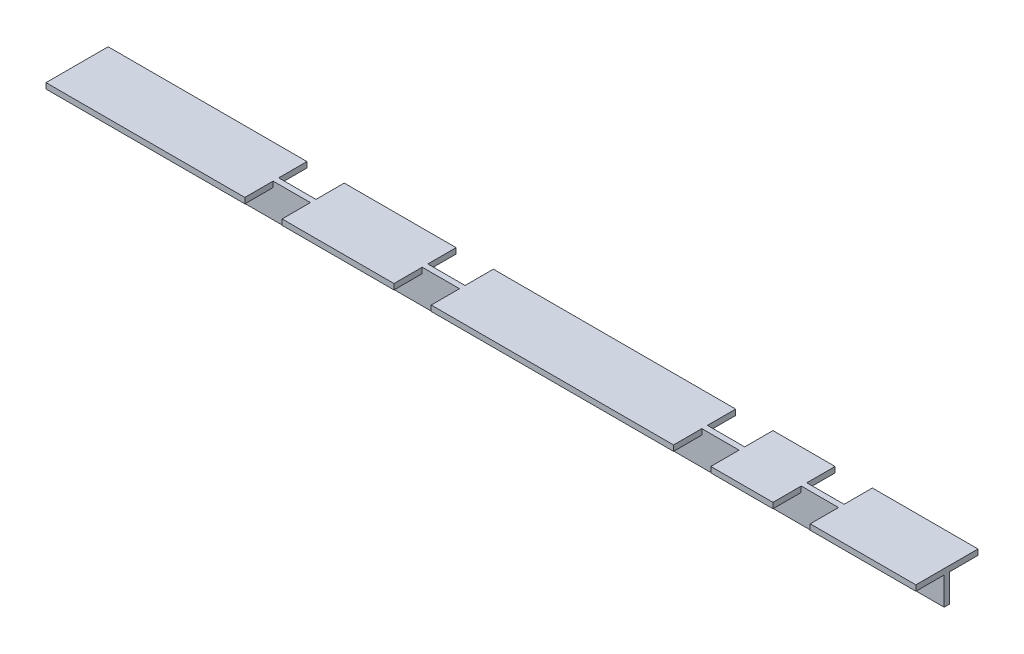
from build123d import *

# Parameters (mm, degrees)
BOSS_EXTRUDE1_DEPTH = 1400
SKETCH1_W           = 60
SKETCH1_H           = 45.5
CUT_EXTRUDE1_DEPTH  = 1405.288075859


with BuildPart() as part:
    # Sketch T → Boss-Extrude1 (new body)
    with BuildSketch(Plane(origin=(0, 0, 0), x_dir=(0, 0, -1), z_dir=(1, 0, 0))):
        Polygon((0, 0), (100, 0), (100, -9), (54.5, -9), (54.5, -54), (45.5, -54), (45.5, -9), (0, -9), align=None)
    extrude(amount=BOSS_EXTRUDE1_DEPTH)

    # Sketch1 → Cut-Extrude1 (cut, through all)
    with BuildSketch(Plane(origin=(0, -9, 0), x_dir=(-1, 0, 0), z_dir=(0, -1, 0))):
        with Locations((-350, 22.75)):
            Rectangle(SKETCH1_W, SKETCH1_H)
        with Locations((-590, 22.75)):
            Rectangle(SKETCH1_W, SKETCH1_H)
        with Locations((-1200, 22.75)):
            Rectangle(SKETCH1_W, SKETCH1_H)
        with Locations((-1200, 77.25)):
            Rectangle(SKETCH1_W, SKETCH1_H)
        with Locations((-590, 77.25)):
            Rectangle(SKETCH1_W, SKETCH1_H)
        with Locations((-350, 77.25)):
            Rectangle(SKETCH1_W, SKETCH1_H)
        with Locations((-1040, 22.75)):
            Rectangle(SKETCH1_W, SKETCH1_H)
        with Locations((-1040, 77.25)):
            Rectangle(SKETCH1_W, SKETCH1_H)
    extrude(amount=-CUT_EXTRUDE1_DEPTH, mode=Mode.SUBTRACT)


solid = part.part
